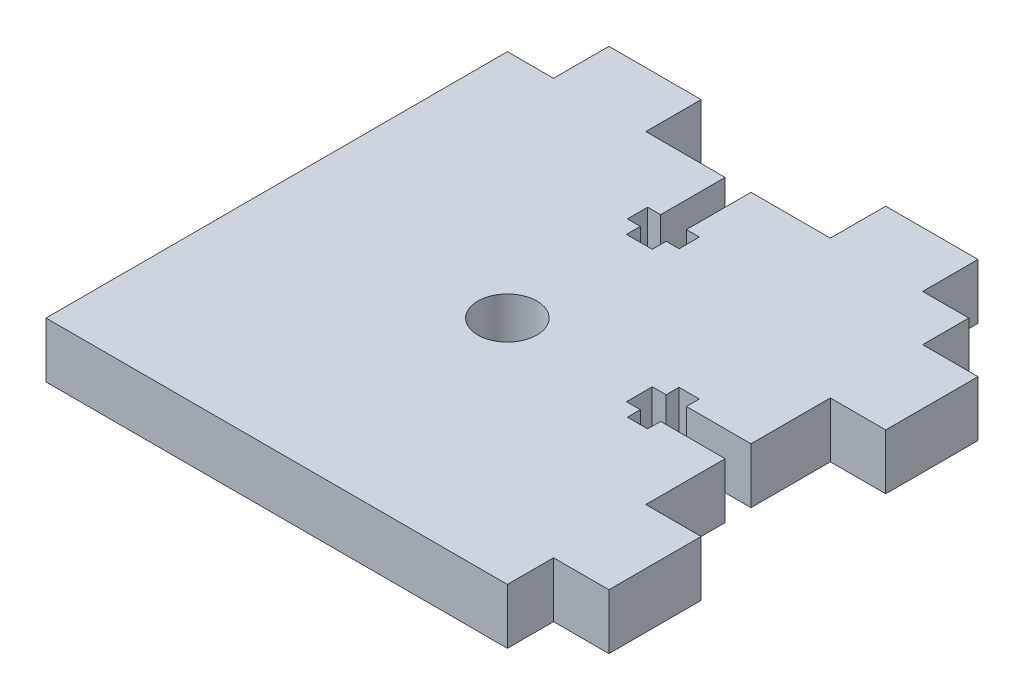
from build123d import *

# Parameters (mm, degrees)
SKETCH_1_R      = 3.2
EXTRUDE_1_DEPTH = 6


with BuildPart() as part:
    # Эскиз1 → Бобышка-Вытянуть1 (new body)
    with BuildSketch(Plane(origin=(0, 0, 0), x_dir=(1, 0, 0), z_dir=(0, 1, 0))):
        Polygon((-27.603963146, 22.034878671), (-27.603963146, -27.965121329), (22.396036854, -27.965121329), (22.396036854, -22.965121329), (28.396036854, -22.965121329), (28.396036854, -12.965121329), (22.396036854, -12.965121329), (22.396036854, -4.365121329), (15.398535816, -4.365121329), (15.398739919, -5.764951191), (13.198739556, -5.765271964), (13.197678648, -4.364354869), (11.697679078, -4.365490812), (11.695559345, -1.566408326), (13.195558915, -1.565272383), (13.194498791, -0.165391578), (15.395321341, -0.165017325), (15.395559431, -1.565121329), (22.395560638, -1.565121329), (22.395560638, 7.034878671), (28.395560638, 7.034878671), (28.395560638, 17.034878671), (22.396036854, 17.034878671), (22.396036854, 22.034878671), (17.396036854, 22.034878671), (17.396036854, 28.034878671), (7.396036854, 28.034878671), (7.396036854, 22.034618289), (-1.203963146, 22.034810758), (-1.203963146, 15.03730972), (0.194846925, 15.037513675), (0.194793578, 12.837275467), (-1.206123677, 12.836452786), (-1.20524281, 11.336452446), (-4.003305339, 11.334809299), (-4.004186206, 12.834809041), (-5.40406717, 12.833986969), (-5.40406717, 15.034809551), (-4.003963146, 15.034809551), (-4.003963146, 22.034810758), (-12.603963146, 22.034878671), (-12.603963146, 28.034878671), (-22.603963146, 28.034878671), (-22.603963146, 22.034878671), align=None)
        with Locations(Location((-2.603963146, -2.965121329, 0), (0, 0, 270))):
            Circle(SKETCH_1_R, mode=Mode.SUBTRACT)
    extrude(amount=EXTRUDE_1_DEPTH)


solid = part.part
